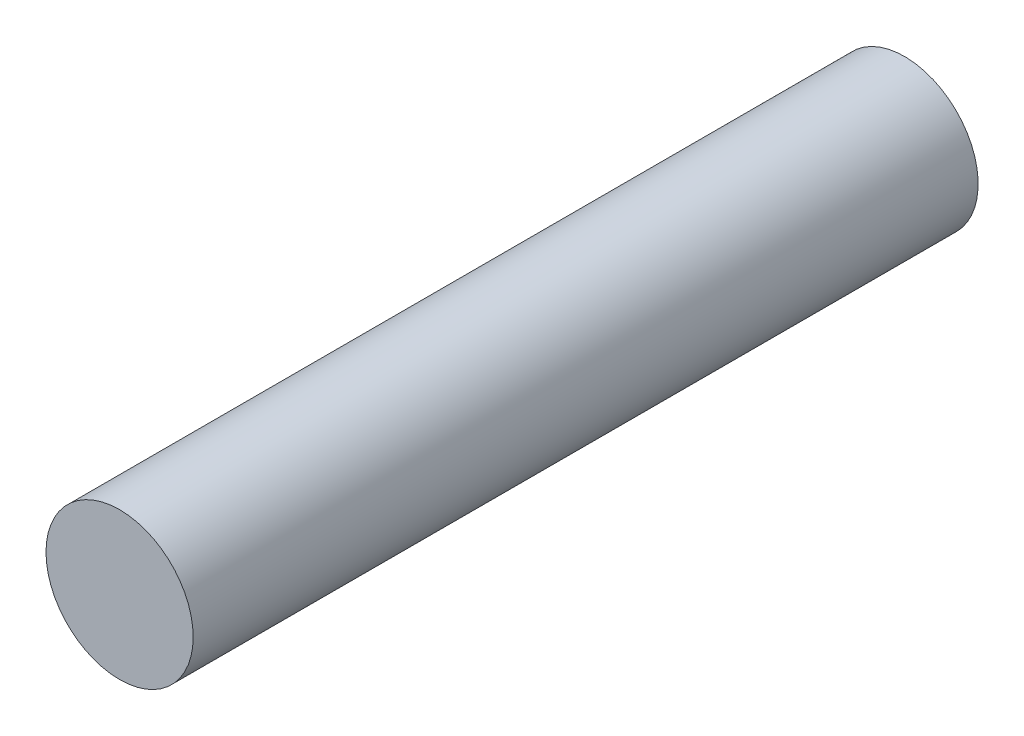
from build123d import *

# Parameters (mm, degrees)
ESQUISSE1_R             = 3
BOSS_EXTRU_1_DEPTH      = 53.5
ESQUISSE5_R             = 3
ENL_V_MAT_EXTRU_4_DEPTH = 21.5


with BuildPart() as part:
    # Esquisse1 → Boss.-Extru.1 (new body)
    with BuildSketch(Plane.XY):
        Circle(ESQUISSE1_R)
    extrude(amount=BOSS_EXTRU_1_DEPTH)

    # Esquisse5 → Enlèv. mat.-Extru.4 (cut)
    with BuildSketch(Plane(origin=(0, 0, 0), x_dir=(-1, 0, 0), z_dir=(0, 0, -1))):
        Circle(ESQUISSE5_R)
    extrude(amount=-ENL_V_MAT_EXTRU_4_DEPTH, mode=Mode.SUBTRACT)


solid = part.part
